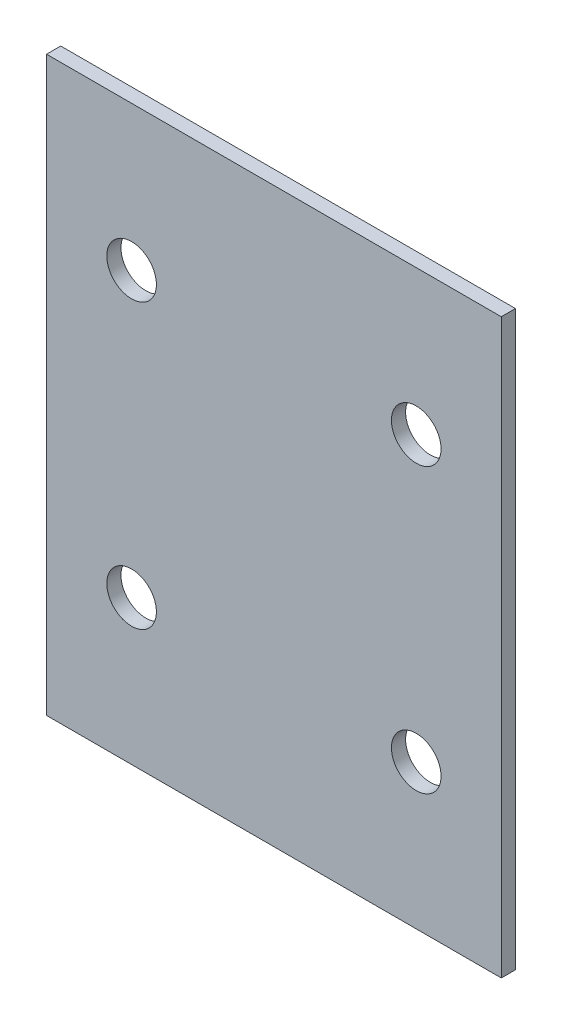
from build123d import *

# Parameters (mm, degrees)
SKETCH1_W           = 203.708
SKETCH1_H           = 256.54
BOSS_EXTRUDE1_DEPTH = 6.35
CUT_EXTRUDE1_REACH  = 326.339
SKETCH2_R           = 11.1125


with BuildPart() as part:
    # Sketch1 → Boss-Extrude1 (new body)
    with BuildSketch(Plane.XY):
        with Locations((81.646636302, 139.093604852)):
            Rectangle(SKETCH1_W, SKETCH1_H)
    extrude(amount=BOSS_EXTRUDE1_DEPTH)

    # Sketch2 → Cut-Extrude1 (cut, up to next)
    with BuildSketch(Plane(origin=(0, 0, 0), x_dir=(-1, 0, 0), z_dir=(0, 0, -1)), mode=Mode.PRIVATE) as cut_extrude1_sk1:
        with Locations((-145.400636302, 202.593604852)):
            Circle(SKETCH2_R)
    cut_extrude1_tool1 = extrude(cut_extrude1_sk1.sketch, amount=-CUT_EXTRUDE1_REACH, mode=Mode.PRIVATE) & part.part
    # Sketch2 → Cut-Extrude1 (cut, up to next)
    with BuildSketch(Plane(origin=(0, 0, 0), x_dir=(-1, 0, 0), z_dir=(0, 0, -1)), mode=Mode.PRIVATE) as cut_extrude1_sk2:
        with Locations((-145.400636302, 75.593604852)):
            Circle(SKETCH2_R)
    cut_extrude1_tool2 = extrude(cut_extrude1_sk2.sketch, amount=-CUT_EXTRUDE1_REACH, mode=Mode.PRIVATE) & part.part
    # Sketch2 → Cut-Extrude1 (cut, up to next)
    with BuildSketch(Plane(origin=(0, 0, 0), x_dir=(-1, 0, 0), z_dir=(0, 0, -1)), mode=Mode.PRIVATE) as cut_extrude1_sk3:
        with Locations((-17.892636302, 202.593604852)):
            Circle(SKETCH2_R)
    cut_extrude1_tool3 = extrude(cut_extrude1_sk3.sketch, amount=-CUT_EXTRUDE1_REACH, mode=Mode.PRIVATE) & part.part
    # Sketch2 → Cut-Extrude1 (cut, up to next)
    with BuildSketch(Plane(origin=(0, 0, 0), x_dir=(-1, 0, 0), z_dir=(0, 0, -1)), mode=Mode.PRIVATE) as cut_extrude1_sk4:
        with Locations((-17.892636302, 75.593604852)):
            Circle(SKETCH2_R)
    cut_extrude1_tool4 = extrude(cut_extrude1_sk4.sketch, amount=-CUT_EXTRUDE1_REACH, mode=Mode.PRIVATE) & part.part
    add(cut_extrude1_tool1.solids().sort_by_distance((145.400636, 202.593605, 0))[0], mode=Mode.SUBTRACT)
    add(cut_extrude1_tool2.solids().sort_by_distance((145.400636, 75.593605, 0))[0], mode=Mode.SUBTRACT)
    add(cut_extrude1_tool3.solids().sort_by_distance((17.892636, 202.593605, 0))[0], mode=Mode.SUBTRACT)
    add(cut_extrude1_tool4.solids().sort_by_distance((17.892636, 75.593605, 0))[0], mode=Mode.SUBTRACT)


solid = part.part
